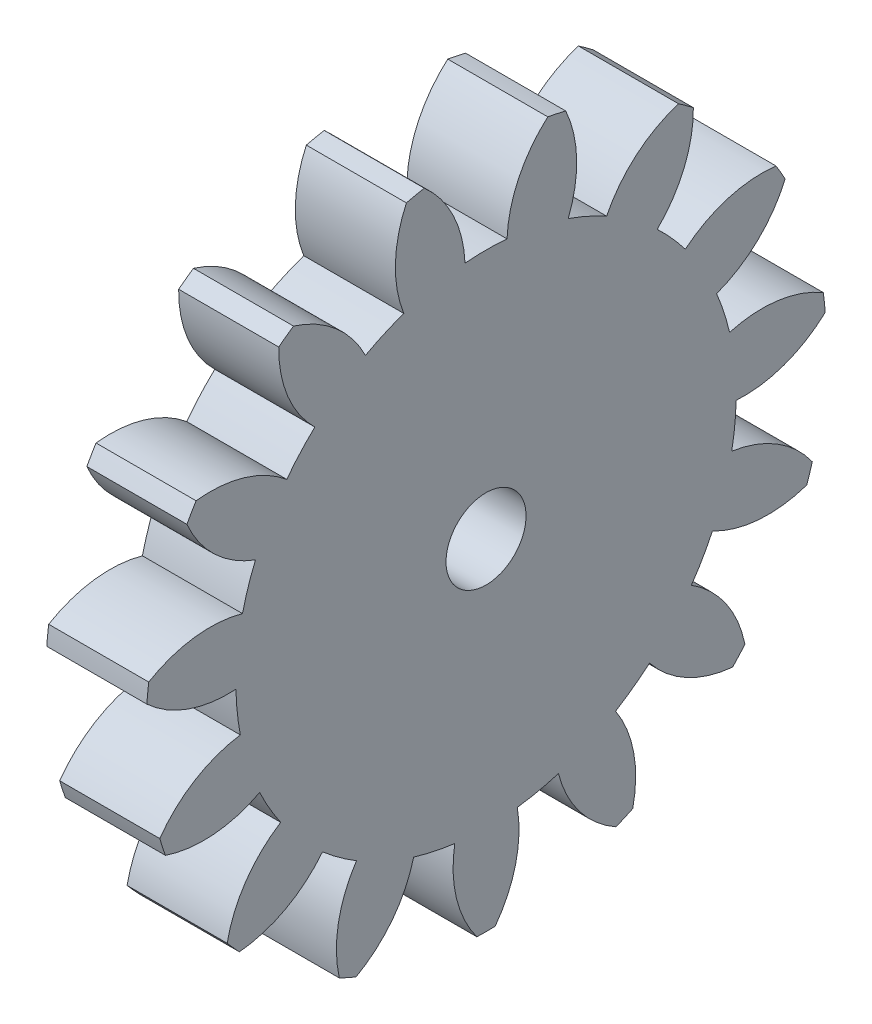
from build123d import *

# Parameters (mm, degrees)
BASPROSKE_W     = 5
BASPROSKE_H     = 17
TOOTHCUT_DEPTH  = 25.556058316
TEETHCUTS_COUNT = 15
TEETHCUTS_ANGLE = 336
BORSKE_R        = 2
BORE_DEPTH      = 50.0000508


with BuildPart() as part:
    # BasProSke → Base-Revolve (revolve)
    with BuildSketch(Plane(origin=(0, 0, 0), x_dir=(1, 0, 0), z_dir=(0, 1, 0)), mode=Mode.PRIVATE) as base_revolve_sk:
        with Locations((2.5, 8.5)):
            Rectangle(BASPROSKE_W, BASPROSKE_H)
    revolve(base_revolve_sk.sketch.rotate(Axis((-10, 0, 0), (1, 0, 0)), 180), axis=Axis((-10, 0, 0), (1, 0, 0)))

    # TooCutSke → ToothCut (cut, through all)
    with BuildSketch(Plane(origin=(0, 0, 0), x_dir=(0, 0, -1), z_dir=(1, 0, 0))):
        with BuildLine():
            ThreePointArc((1.050056448, 12.454813626), (0, 12.499), (-1.050056448, 12.454813626))
            ThreePointArc((-1.050056448, 12.454813626), (-1.638118106, 14.809604533), (-3.110934279, 16.73876737))
            ThreePointArc((-3.110934279, 16.73876737), (0, 17.0254), (3.110934279, 16.73876737))
            ThreePointArc((3.110934279, 16.73876737), (1.638118106, 14.809604533), (1.050056448, 12.454813626))
        make_face()
    toothcut = extrude(amount=TOOTHCUT_DEPTH, mode=Mode.SUBTRACT)

    # TeethCuts: ToothCut ×15 about axis
    teethcuts_axis = Axis((-10, 0, 0), (1, 0, 0))
    for i in range(1, TEETHCUTS_COUNT):
        add(toothcut.rotate(teethcuts_axis, i * TEETHCUTS_ANGLE / (TEETHCUTS_COUNT - 1)), mode=Mode.SUBTRACT)

    # BorSke → Bore (cut, symmetric)
    with BuildSketch(Plane(origin=(0, 0, 0), x_dir=(0, 0, -1), z_dir=(1, 0, 0))):
        with Locations(Location((0, 0, 0), (0, 0, 180))):
            Circle(BORSKE_R)
    extrude(amount=BORE_DEPTH, both=True, mode=Mode.SUBTRACT)


solid = part.part
